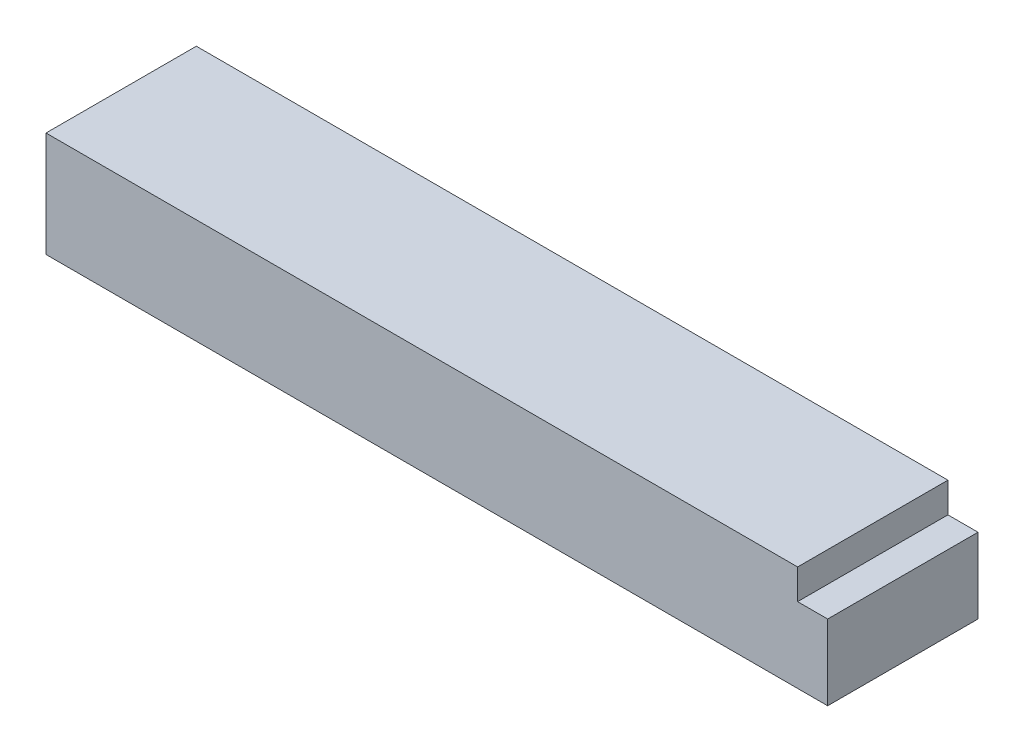
from build123d import *

# Parameters (mm, degrees)
BOSS_EXTRUDE1_DEPTH = 20


with BuildPart() as part:
    # Sketch1 → Boss-Extrude1 (new body)
    with BuildSketch(Plane.XY):
        Polygon((-89.862068966, 8.396551724), (-89.862068966, -5.603448276), (14.137931034, -5.603448276), (14.137931034, 4.396551724), (10.137931034, 4.396551724), (10.137931034, 8.396551724), align=None)
    extrude(amount=BOSS_EXTRUDE1_DEPTH)


solid = part.part
